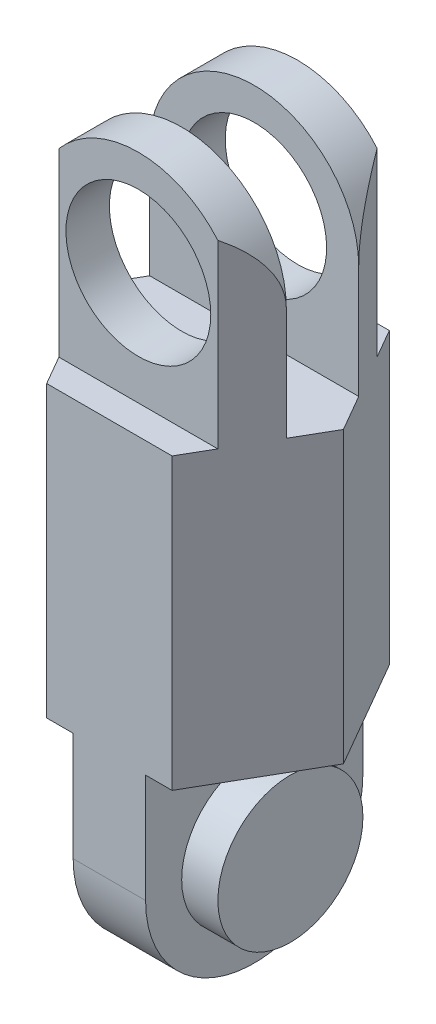
from build123d import *

# Parameters (mm, degrees)
SALIENTE_EXTRUIR1_DEPTH    = 50
CORTAR_EXTRUIR1_DEPTH      = 56
CORTAR_EXTRUIR1_DEPTH_BACK = 56
CROQUIS2_W                 = 12.320508076
CROQUIS2_H                 = 30
CORTAR_EXTRUIR2_DEPTH      = 57.773277876
CORTAR_EXTRUIR2_DEPTH_BACK = 57.773277876
CROQUIS5_R                 = 10.01543576
SALIENTE_EXTRUIR2_DEPTH    = 10
CORTAR_EXTRUIR3_DEPTH      = 56
CORTAR_EXTRUIR3_DEPTH_BACK = 56
CROQUIS6_W                 = 10
CROQUIS6_H                 = 30
CROQUIS6_W_2               = 4
CORTAR_EXTRUIR4_DEPTH      = 56
CORTAR_EXTRUIR4_DEPTH_BACK = 56
CROQUIS7_R                 = 10


with BuildPart() as part:
    # Croquis1 → Saliente-Extruir1 (new, symmetric)
    with BuildSketch(Plane(origin=(0, 0, 0), x_dir=(1, 0, 0), z_dir=(0, 1, 0))):
        Polygon((-17.320508076, 0), (-8.660254038, -15), (8.660254038, -15), (17.320508076, 0), (8.660254038, 15), (-8.660254038, 15), align=None)
    extrude(amount=SALIENTE_EXTRUIR1_DEPTH, both=True)

    # Croquis2 → Cortar-Extruir1 (cut, two sides: drawn at the far end of the back side and taken through both)
    with BuildSketch(Plane.XY.offset(-CORTAR_EXTRUIR1_DEPTH_BACK)):
        with Locations((-11.160254038, -35)):
            Rectangle(CROQUIS2_W, CROQUIS2_H)
        with Locations((11.160254038, -35)):
            Rectangle(CROQUIS2_W, CROQUIS2_H)
    extrude(amount=CORTAR_EXTRUIR1_DEPTH + CORTAR_EXTRUIR1_DEPTH_BACK, mode=Mode.SUBTRACT)

    # Croquis3 → Cortar-Extruir2 (cut, two sides: drawn at the far end of the back side and taken through both)
    with BuildSketch(Plane(origin=(5, 0, 0), x_dir=(0, 0, -1), z_dir=(1, 0, 0)).offset(-CORTAR_EXTRUIR2_DEPTH_BACK)):
        with BuildLine():
            Line((-15, -35), (-15, -53.002669734))
            Line((-15, -53.002669734), (15, -53.002669734))
            Line((15, -53.002669734), (15, -35))
            ThreePointArc((15, -35), (0, -50), (-15, -35))
        make_face()
    extrude(amount=CORTAR_EXTRUIR2_DEPTH + CORTAR_EXTRUIR2_DEPTH_BACK, mode=Mode.SUBTRACT)

    # Croquis5 → Saliente-Extruir2 (add, symmetric)
    with BuildSketch(Plane(origin=(0, 0, 0), x_dir=(0, 0, -1), z_dir=(1, 0, 0))):
        with Locations((0, -35)):
            Circle(CROQUIS5_R)
    extrude(amount=SALIENTE_EXTRUIR2_DEPTH, both=True)

    # Croquis6 → Cortar-Extruir3 (cut, two sides: drawn at the far end of the back side and taken through both)
    with BuildSketch(Plane(origin=(0, 0, 0), x_dir=(0, 0, -1), z_dir=(1, 0, 0)).offset(-CORTAR_EXTRUIR3_DEPTH_BACK)):
        with Locations((0, 35)):
            Rectangle(CROQUIS6_W, CROQUIS6_H)
        with Locations((-13, 35)):
            Rectangle(CROQUIS6_W_2, CROQUIS6_H)
        with Locations((13, 35)):
            Rectangle(CROQUIS6_W_2, CROQUIS6_H)
    extrude(amount=CORTAR_EXTRUIR3_DEPTH + CORTAR_EXTRUIR3_DEPTH_BACK, mode=Mode.SUBTRACT)

    # Croquis7 → Cortar-Extruir4 (cut, two sides: drawn at the far end of the back side and taken through both)
    with BuildSketch(Plane.XY.offset(-CORTAR_EXTRUIR4_DEPTH_BACK)):
        with Locations(Location((0, 35.56624327, 0), (0, 0, 270))):
            Circle(CROQUIS7_R)
        with BuildLine():
            Line((-14.43375673, 35.56624327), (-14.43375673, 54.061973256))
            Line((-14.43375673, 54.061973256), (14.43375673, 54.061973256))
            Line((14.43375673, 54.061973256), (14.43375673, 35.56624327))
            ThreePointArc((14.43375673, 35.56624327), (0, 50), (-14.43375673, 35.56624327))
        make_face()
    extrude(amount=CORTAR_EXTRUIR4_DEPTH + CORTAR_EXTRUIR4_DEPTH_BACK, mode=Mode.SUBTRACT)


solid = part.part
